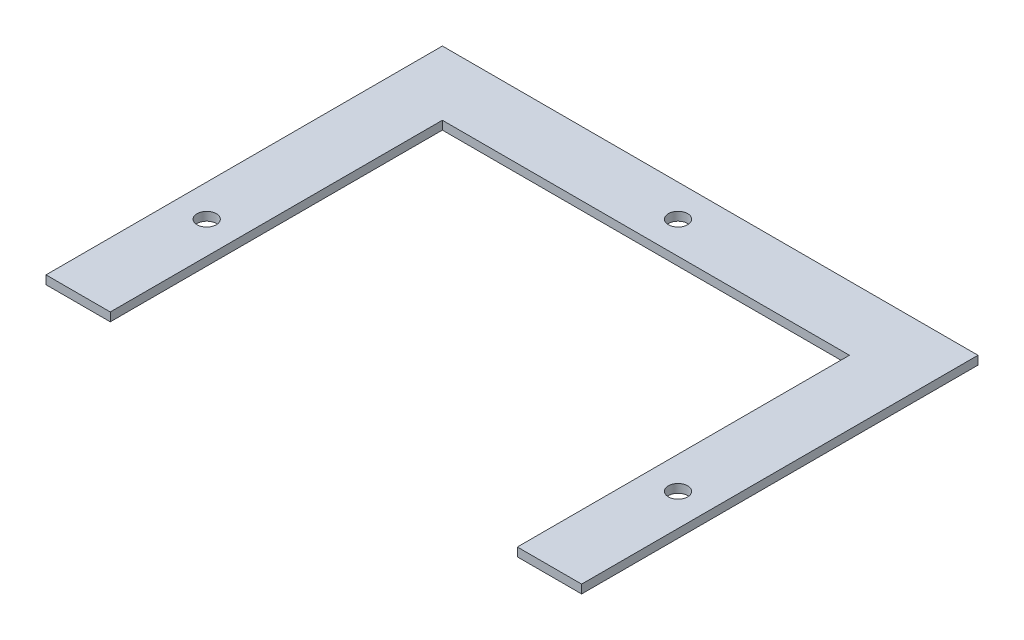
from build123d import *

# Parameters (mm, degrees)
SKETCH1_W            = 250
SKETCH1_H            = 285
SKETCH1_W_2          = 190
SKETCH1_H_2          = 225
EXTRUDE_THIN1_DEPTH  = 4
SKETCH2_W            = 250
SKETCH2_H            = 100
CUT_EXTRUDE1_DEPTH   = 10
SKETCH3_R            = 4.5
CUT_EXTRUDE2_DEPTH   = 10
LPATTERN1_COUNT      = 2
LPATTERN1_PITCH      = 144.5
LPATTERN1_COUNT_DIR2 = 2
LPATTERN1_PITCH_DIR2 = 144.5
SKETCH4_R            = 4.5
CUT_EXTRUDE3_DEPTH   = 10


with BuildPart() as part:
    # Sketch1 → Extrude-Thin1 (new body)
    with BuildSketch(Plane(origin=(0, 0, 0), x_dir=(1, 0, 0), z_dir=(0, 1, 0))):
        Rectangle(SKETCH1_W, SKETCH1_H)
        Rectangle(SKETCH1_W_2, SKETCH1_H_2, mode=Mode.SUBTRACT)
    extrude(amount=EXTRUDE_THIN1_DEPTH)

    # Sketch2 → Cut-Extrude1 (cut)
    with BuildSketch(Plane.XZ):
        with Locations((0, 92.5)):
            Rectangle(SKETCH2_W, SKETCH2_H)
    extrude(amount=-CUT_EXTRUDE1_DEPTH, mode=Mode.SUBTRACT)

    # Sketch3 → Cut-Extrude2 (cut)
    with BuildSketch(Plane.XZ):
        with Locations(Location((0, -127.5, 0), (0, 0, 270))):
            Circle(SKETCH3_R)
    cut_extrude2 = extrude(amount=-CUT_EXTRUDE2_DEPTH, mode=Mode.SUBTRACT)

    # LPattern1: Cut-Extrude2 2 × 2
    with Locations(*[Vector(-1, 0, 0) * (i * LPATTERN1_PITCH) + Vector(-1, 0, 0) * (j * LPATTERN1_PITCH_DIR2) for i in range(LPATTERN1_COUNT) for j in range(LPATTERN1_COUNT_DIR2) if (i, j) != (0, 0)]):
        add(cut_extrude2, mode=Mode.SUBTRACT)

    # Sketch4 → Cut-Extrude3 (cut)
    with BuildSketch(Plane(origin=(0, 0, 0), x_dir=(-1, 0, 0), z_dir=(0, -1, 0))):
        with Locations(Location((110, 17.5, 0), (0, 0, 90))):
            Circle(SKETCH4_R)
    cut_extrude3 = extrude(amount=-CUT_EXTRUDE3_DEPTH, mode=Mode.SUBTRACT)

    # Mirror1: Cut-Extrude3 across plane
    add(cut_extrude3.mirror(Plane(origin=(0, 0, 0), x_dir=(0, 0, 1), z_dir=(1, 0, 0))), mode=Mode.SUBTRACT)


solid = part.part
